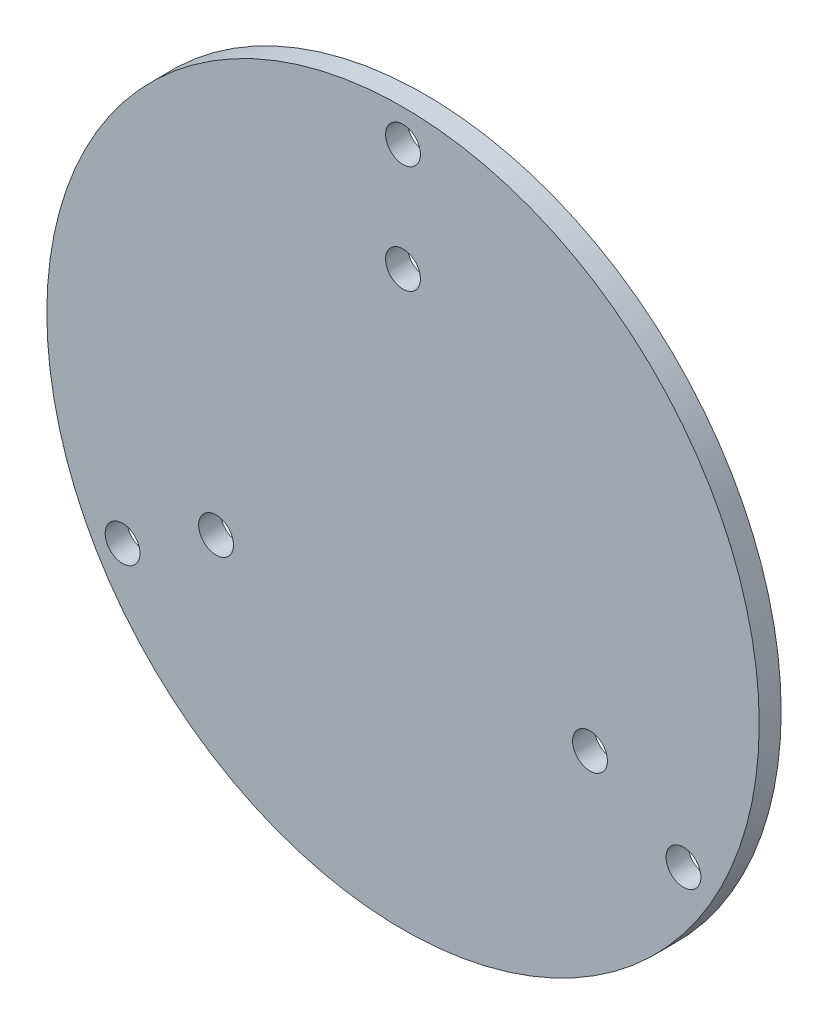
from build123d import *

# Parameters (mm, degrees)
SKETCH1_R             = 16.5
EXTRUDE1_DEPTH        = 1.016
F_0_CLEARANCE_HOLE1_D = 1.6129
SKETCH6_R             = 0.80645
CUT_EXTRUDE1_DEPTH    = 5


with BuildPart() as part:
    # Sketch1 → Extrude1 (new body)
    with BuildSketch(Plane.XY):
        Circle(SKETCH1_R)
    extrude(amount=EXTRUDE1_DEPTH)

    # #0 Clearance Hole1 (through all)
    with Locations(Plane(origin=(0, 10, 0), x_dir=(-1, 0, 0), z_dir=(0, 0, -1))):
        with Locations((0, 0), (8.660254038, -15), (-8.660254038, -15)):
            Hole(F_0_CLEARANCE_HOLE1_D / 2)

    # Sketch6 → Cut-Extrude1 (cut)
    with BuildSketch(Plane.XY.offset(1.016)):
        with Locations((0, 15)):
            Circle(SKETCH6_R)
        with Locations((12.990381057, -7.5)):
            Circle(SKETCH6_R)
        with Locations((-12.990381057, -7.5)):
            Circle(SKETCH6_R)
    extrude(amount=-CUT_EXTRUDE1_DEPTH, mode=Mode.SUBTRACT)


solid = part.part
